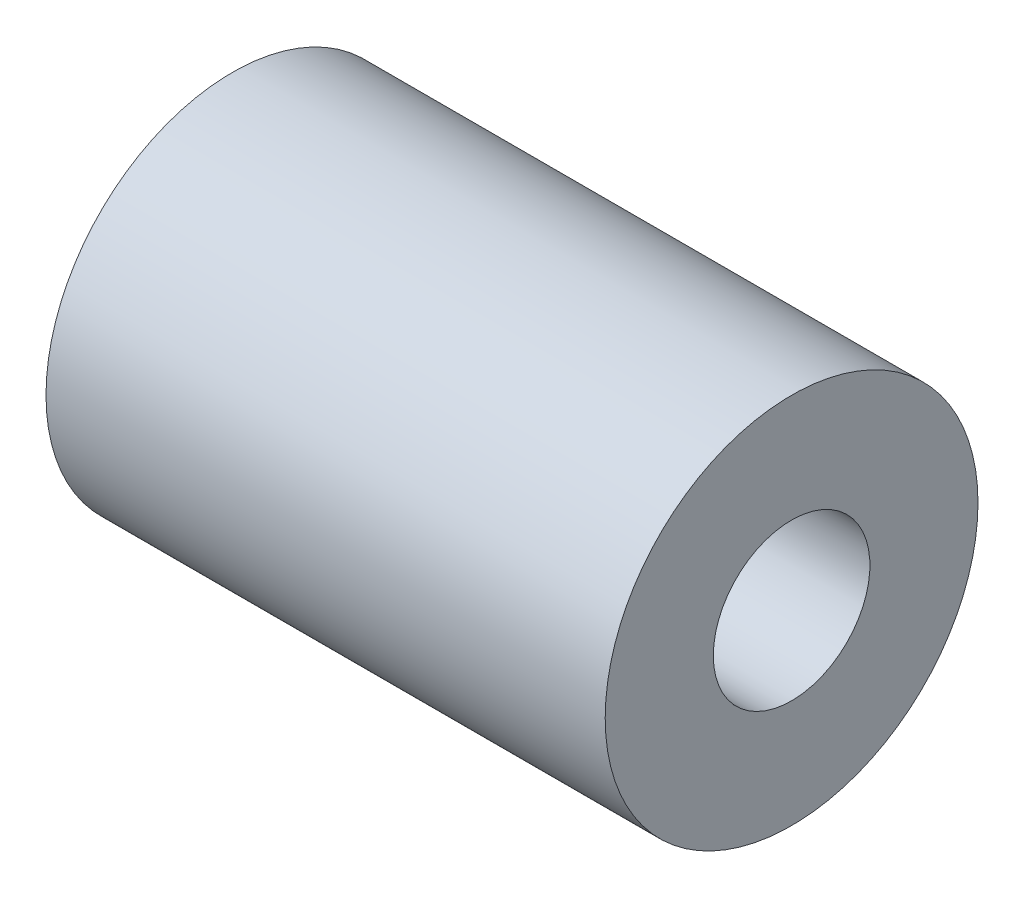
from build123d import *

# Parameters (mm, degrees)
SKETCH1_R           = 25.4
SKETCH1_R_2         = 10.67
BOSS_EXTRUDE1_DEPTH = 38.1


with BuildPart() as part:
    # Sketch1 → Boss-Extrude1 (new, symmetric)
    with BuildSketch(Plane(origin=(0, 0, 0), x_dir=(0, 0, -1), z_dir=(1, 0, 0))):
        with Locations(Location((0, 0, 0), (0, 0, 180))):
            Circle(SKETCH1_R)
        with Locations(Location((0, 0, 0), (0, 0, 180))):
            Circle(SKETCH1_R_2, mode=Mode.SUBTRACT)
    extrude(amount=BOSS_EXTRUDE1_DEPTH, both=True)


solid = part.part
